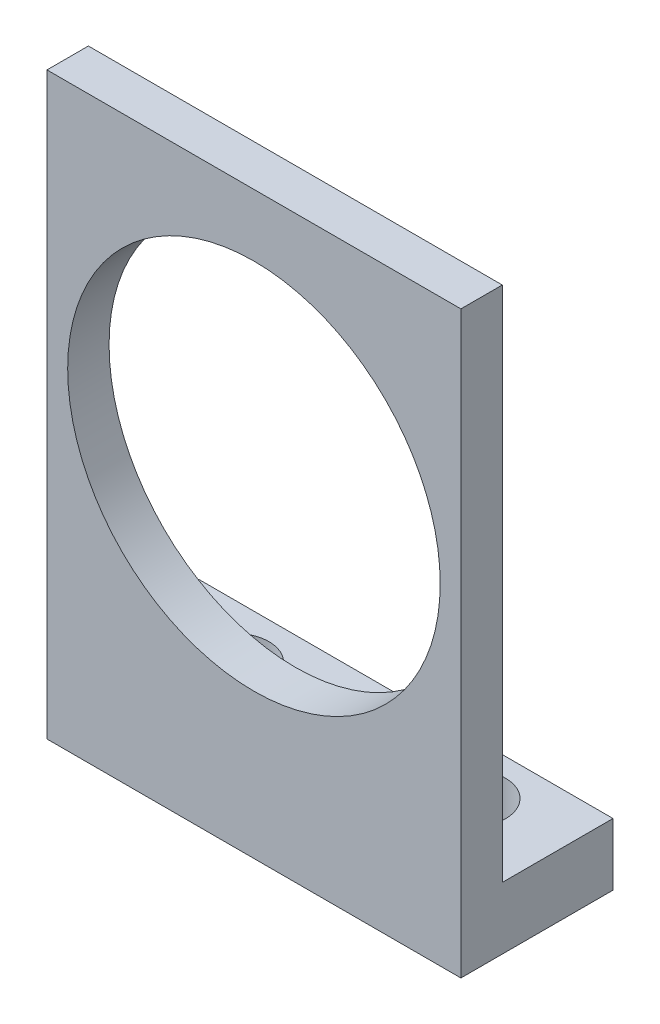
from build123d import *

# Parameters (mm, degrees)
SKETCH1_W            = 20
SKETCH1_H            = 25
BOSS_EXTRUDE1_DEPTH  = 2
SKETCH2_W            = 20
SKETCH2_H            = 12.7
BOSS_EXTRUDE2_DEPTH  = 3
M3_CLEARANCE_HOLE1_D = 3.4
SKETCH7_R            = 9
CUT_EXTRUDE1_DEPTH   = 20.856296231
SKETCH8_W            = 20
SKETCH8_H            = 5.35
CUT_EXTRUDE2_DEPTH   = 28.910974544


with BuildPart() as part:
    # Sketch1 → Boss-Extrude1 (new body)
    with BuildSketch(Plane.XY):
        Rectangle(SKETCH1_W, SKETCH1_H)
    extrude(amount=BOSS_EXTRUDE1_DEPTH)

    # Sketch2 → Boss-Extrude2 (add)
    with BuildSketch(Plane.XZ.offset(12.5)):
        with Locations((0, 1)):
            Rectangle(SKETCH2_W, SKETCH2_H)
    extrude(amount=BOSS_EXTRUDE2_DEPTH)

    # M3 Clearance Hole1 (through all)
    with Locations(Plane(origin=(0, -12.5, 0), x_dir=(1, 0, 0), z_dir=(0, 1, 0))):
        with Locations((-5.715, 2.739497088), (5.715, 2.739497088)):
            Hole(M3_CLEARANCE_HOLE1_D / 2)

    # Sketch7 → Cut-Extrude1 (cut, through all)
    with BuildSketch(Plane.XY.offset(2)):
        with Locations((0, 0.5)):
            Circle(SKETCH7_R)
    extrude(amount=-CUT_EXTRUDE1_DEPTH, mode=Mode.SUBTRACT)

    # Sketch8 → Cut-Extrude2 (cut, through all)
    with BuildSketch(Plane(origin=(0, -12.5, 0), x_dir=(1, 0, 0), z_dir=(0, 1, 0))):
        with Locations((0, -4.675)):
            Rectangle(SKETCH8_W, SKETCH8_H)
    extrude(amount=-CUT_EXTRUDE2_DEPTH, mode=Mode.SUBTRACT)


solid = part.part
